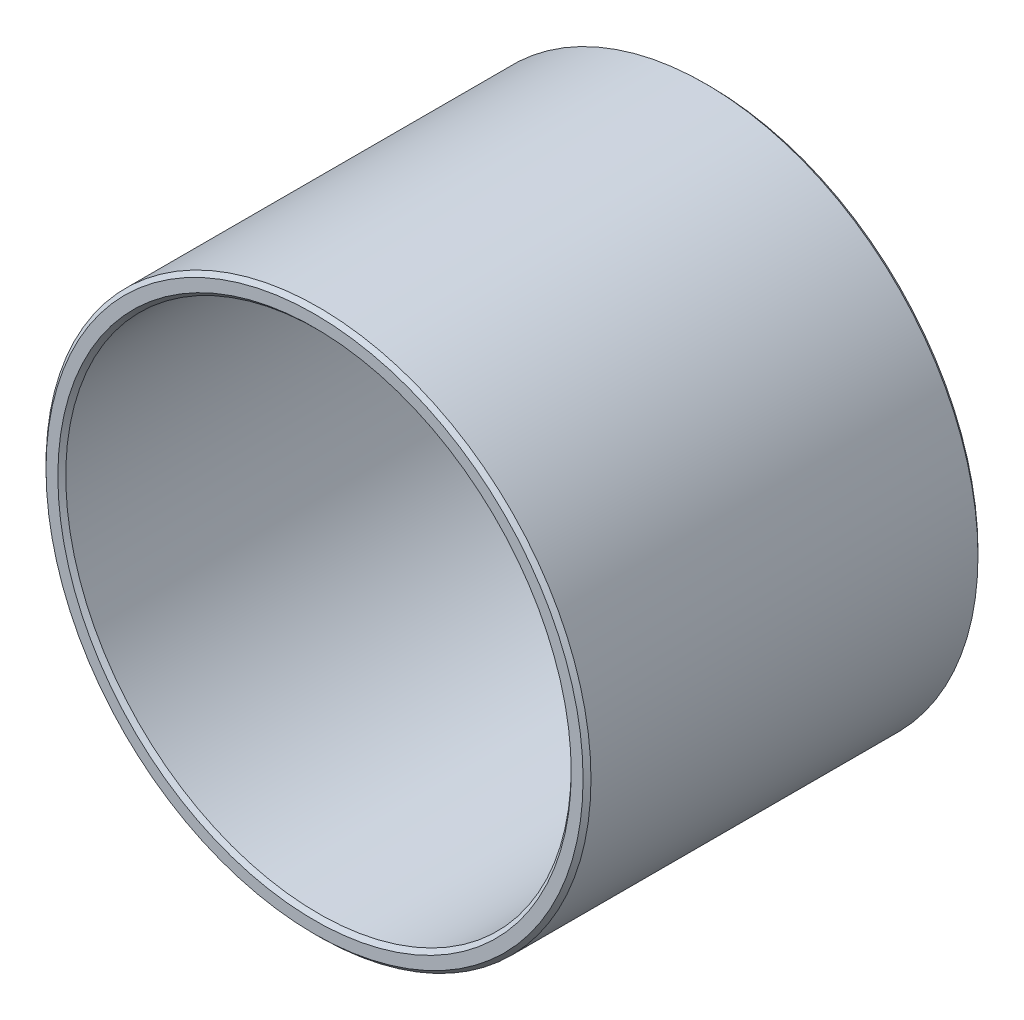
from build123d import *

# Parameters (mm, degrees)
BOSS_EXTRUDE1_START = 17.5
SKETCH1_R           = 34.5
SKETCH1_R_2         = 32
BOSS_EXTRUDE1_DEPTH = 50
CHAMFER1_SIZE       = 0.5


with BuildPart() as part:
    # Sketch1 → Boss-Extrude1 (new body)
    with BuildSketch(Plane.XY.offset(BOSS_EXTRUDE1_START)):
        Circle(SKETCH1_R)
        Circle(SKETCH1_R_2, mode=Mode.SUBTRACT)
    extrude(amount=-BOSS_EXTRUDE1_DEPTH)

    # Chamfer1
    chamfer1_edges = [part.edges().sort_by_distance(p)[0] for p in [
        (-34.5, 0, 17.5),
        (-32, 0, 17.5),
        (-34.5, 0, -32.5),
        (-32, 0, -32.5),
    ]]
    chamfer(chamfer1_edges, length=CHAMFER1_SIZE)


solid = part.part
